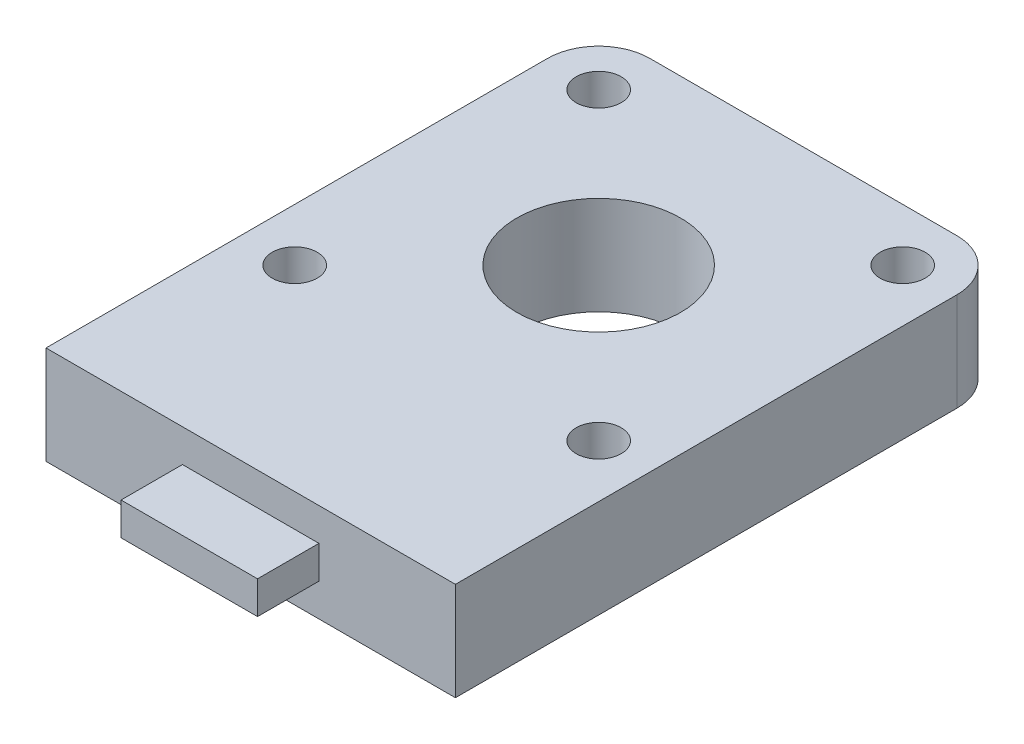
from build123d import *

# Parameters (mm, degrees)
SKETCH_1_W      = 20
SKETCH_1_H      = 27
SKETCH_1_R      = 1.1
SKETCH_1_R_2    = 4
EXTRUDE_1_DEPTH = 4.8
FILLET_3_R      = 2.5
FILLET_4_R      = 2.5
SKETCH_2_W      = 6.666666666
SKETCH_2_H      = 1.6
EXTRUDE_2_DEPTH = 3


with BuildPart() as part:
    # 草图1 → 凸台-拉伸1 (new body)
    with BuildSketch(Plane(origin=(0, 0, 0), x_dir=(1, 0, 0), z_dir=(0, 1, 0))):
        with Locations((0, -3.5)):
            Rectangle(SKETCH_1_W, SKETCH_1_H)
        with Locations(Location((7.424621202, 7.424621202, 0), (0, 0, 270))):
            Circle(SKETCH_1_R, mode=Mode.SUBTRACT)
        with Locations(Location((7.424621202, -7.424621202, 0), (0, 0, 270))):
            Circle(SKETCH_1_R, mode=Mode.SUBTRACT)
        with Locations(Location((-7.424621202, -7.424621202, 0), (0, 0, 270))):
            Circle(SKETCH_1_R, mode=Mode.SUBTRACT)
        with Locations(Location((-7.424621202, 7.424621202, 0), (0, 0, 270))):
            Circle(SKETCH_1_R, mode=Mode.SUBTRACT)
        with Locations(Location((0, 0, 0), (0, 0, 270))):
            Circle(SKETCH_1_R_2, mode=Mode.SUBTRACT)
    extrude(amount=EXTRUDE_1_DEPTH)

    # 圆角3
    fillet_3_edges = [part.edges().sort_by_distance(p)[0] for p in [
        (-10, 2.4, -10),
    ]]
    fillet(fillet_3_edges, radius=FILLET_3_R)

    # 圆角4
    fillet_4_edges = [part.edges().sort_by_distance(p)[0] for p in [
        (10, 2.4, -10),
    ]]
    fillet(fillet_4_edges, radius=FILLET_4_R)

    # 草图2 → 凸台-拉伸2 (add)
    with BuildSketch(Plane.XY.offset(17)):
        with Locations((0, 2.4)):
            Rectangle(SKETCH_2_W, SKETCH_2_H)
    extrude(amount=EXTRUDE_2_DEPTH)


solid = part.part
